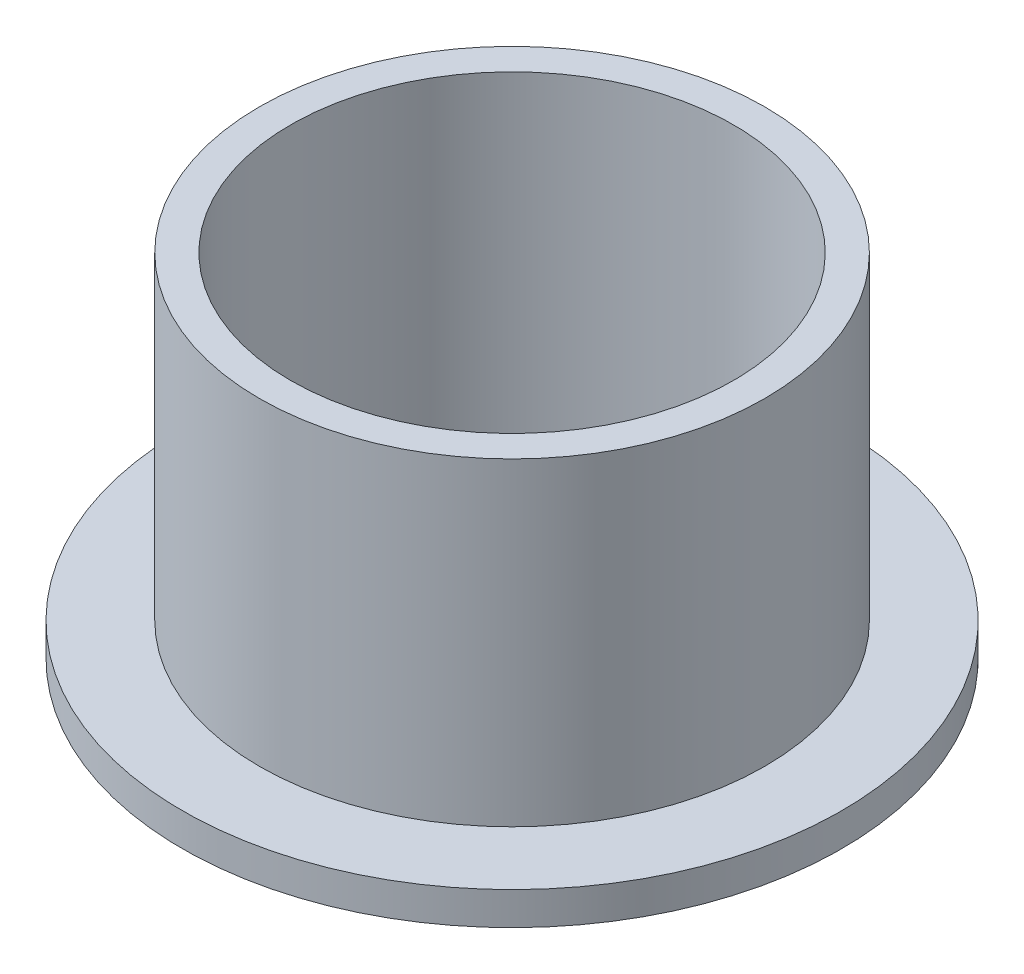
from build123d import *

# Parameters (mm, degrees)
SKETCH2_R           = 9.128125
SKETCH2_R_2         = 8.001
BOSS_EXTRUDE1_DEPTH = 12.7
SKETCH3_R           = 11.90625
SKETCH3_R_2         = 9.128125
BOSS_EXTRUDE2_DEPTH = 1.190625


with BuildPart() as part:
    # Sketch2 → Boss-Extrude1 (new body)
    with BuildSketch(Plane(origin=(0, 0, 0), x_dir=(1, 0, 0), z_dir=(0, 1, 0))):
        with Locations(Location((0, 0, 0), (0, 0, 270))):
            Circle(SKETCH2_R)
        with Locations(Location((0, 0, 0), (0, 0, 270))):
            Circle(SKETCH2_R_2, mode=Mode.SUBTRACT)
    extrude(amount=BOSS_EXTRUDE1_DEPTH)

    # Sketch3 → Boss-Extrude2 (add)
    with BuildSketch(Plane(origin=(0, 0, 0), x_dir=(1, 0, 0), z_dir=(0, 1, 0))):
        with Locations(Location((0, 0, 0), (0, 0, 90))):
            Circle(SKETCH3_R)
        with Locations(Location((0, 0, 0), (0, 0, 270))):
            Circle(SKETCH3_R_2, mode=Mode.SUBTRACT)
    extrude(amount=BOSS_EXTRUDE2_DEPTH)


solid = part.part
